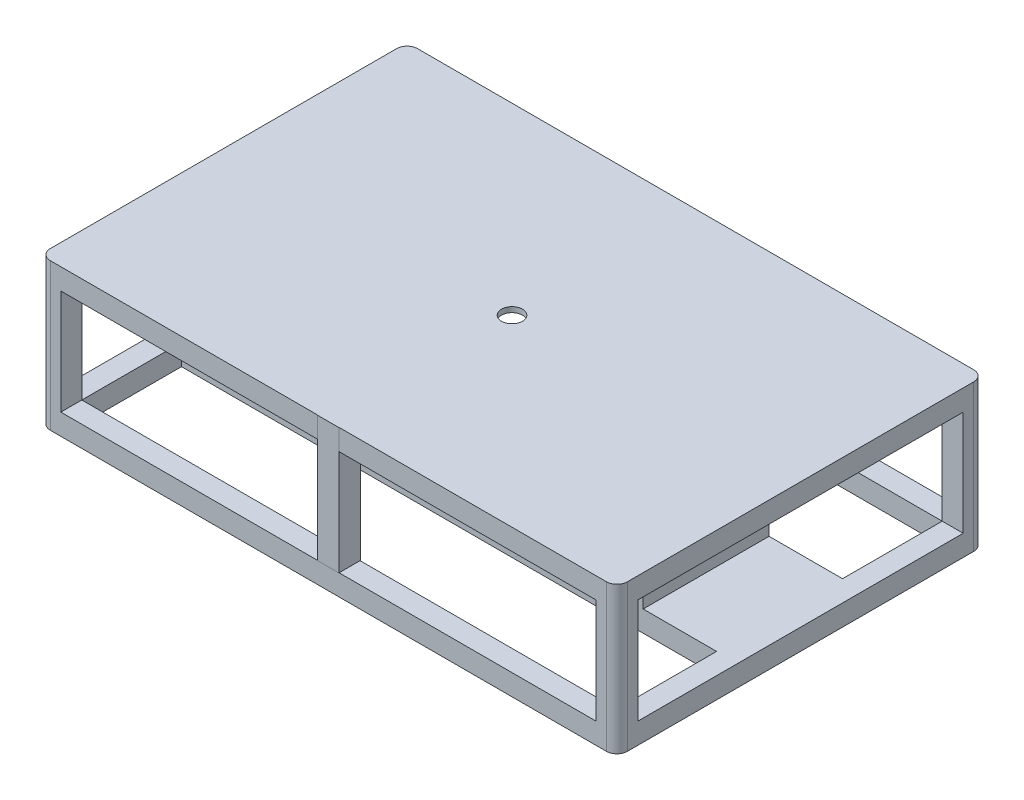
from build123d import *

# Parameters (mm, degrees)
SKETCH1_W           = 550
SKETCH1_H           = 350
SKETCH1_W_2         = 510
SKETCH1_H_2         = 310
BOSS_EXTRUDE1_DEPTH = 20
SKETCH3_W           = 20
SKETCH3_H           = 20
SKETCH3_W_2         = 20.022451752
SKETCH3_H_2         = 20.022451752
SKETCH3_W_3         = 20.433308148
SKETCH3_H_3         = 20.433308148
BOSS_EXTRUDE2_DEPTH = 120
SKETCH4_W           = 550
SKETCH4_H           = 350
SKETCH4_W_2         = 510
SKETCH4_H_2         = 310
BOSS_EXTRUDE3_DEPTH = 20
SKETCH5_W           = 550
SKETCH5_H           = 350
BOSS_EXTRUDE4_DEPTH = 5
SKETCH6_W           = 550
SKETCH6_H           = 120
BOSS_EXTRUDE5_DEPTH = 20
SKETCH7_W           = 49.868309686
SKETCH7_H           = 40
SKETCH7_W_2         = 49.961884124
BOSS_EXTRUDE6_DEPTH = 120
SKETCH8_R           = 5
CUT_EXTRUDE1_DEPTH  = 181
FILLET1_R           = 10
SKETCH9_R           = 10
CUT_EXTRUDE2_DEPTH  = 43


with BuildPart() as part:
    # Sketch1 → Boss-Extrude1 (new body)
    with BuildSketch(Plane(origin=(0, 0, 0), x_dir=(1, 0, 0), z_dir=(0, 1, 0))):
        Rectangle(SKETCH1_W, SKETCH1_H)
        Rectangle(SKETCH1_W_2, SKETCH1_H_2, mode=Mode.SUBTRACT)
    extrude(amount=BOSS_EXTRUDE1_DEPTH)

    # Sketch3 → Boss-Extrude2 (add)
    with BuildSketch(Plane(origin=(0, 20, 0), x_dir=(1, 0, 0), z_dir=(0, 1, 0))):
        with Locations((-265, 165)):
            Rectangle(SKETCH3_W, SKETCH3_H)
        with Locations((-265, -165)):
            Rectangle(SKETCH3_W, SKETCH3_H)
        with Locations((265, -165)):
            Rectangle(SKETCH3_W, SKETCH3_H)
        with Locations((265, 165)):
            Rectangle(SKETCH3_W, SKETCH3_H)
        with Locations((0, 165)):
            Rectangle(SKETCH3_W_2, SKETCH3_H_2)
        with Locations((0, -165)):
            Rectangle(SKETCH3_W_3, SKETCH3_H_3)
    extrude(amount=BOSS_EXTRUDE2_DEPTH)

    # Sketch4 → Boss-Extrude3 (add)
    with BuildSketch(Plane(origin=(0, 140, 0), x_dir=(1, 0, 0), z_dir=(0, 1, 0))):
        Rectangle(SKETCH4_W, SKETCH4_H)
        Rectangle(SKETCH4_W_2, SKETCH4_H_2, mode=Mode.SUBTRACT)
    extrude(amount=-BOSS_EXTRUDE3_DEPTH)

    # Sketch5 → Boss-Extrude4 (add)
    with BuildSketch(Plane(origin=(0, 140, 0), x_dir=(1, 0, 0), z_dir=(0, 1, 0))):
        Rectangle(SKETCH5_W, SKETCH5_H)
    extrude(amount=-BOSS_EXTRUDE4_DEPTH)

    # Sketch6 → Boss-Extrude5 (add)
    with BuildSketch(Plane.XZ):
        Rectangle(SKETCH6_W, SKETCH6_H)
    extrude(amount=-BOSS_EXTRUDE5_DEPTH)

    # Sketch7 → Boss-Extrude6 (add)
    with BuildSketch(Plane.XY.offset(60)):
        with Locations((-159.939483021, 20)):
            Rectangle(SKETCH7_W, SKETCH7_H)
        with Locations((160.017500796, 20)):
            Rectangle(SKETCH7_W_2, SKETCH7_H)
    extrude(amount=-BOSS_EXTRUDE6_DEPTH)

    # Sketch8 → Cut-Extrude1 (cut)
    with BuildSketch(Plane.XY.offset(60)):
        with Locations((160.017500796, 20)):
            Circle(SKETCH8_R)
        with Locations((-159.939483021, 20)):
            Circle(SKETCH8_R)
    extrude(amount=-CUT_EXTRUDE1_DEPTH, mode=Mode.SUBTRACT)

    # Fillet1
    fillet1_edges = [part.edges().sort_by_distance(p)[0] for p in [
        (275, 70, 175),
        (-275, 70, 175),
        (-275, 70, -175),
        (275, 70, -175),
    ]]
    fillet(fillet1_edges, radius=FILLET1_R)

    # Sketch9 → Cut-Extrude2 (cut)
    with BuildSketch(Plane(origin=(0, 140, 0), x_dir=(1, 0, 0), z_dir=(0, 1, 0))):
        with Locations(Location((0, 0, 0), (0, 0, 270))):
            Circle(SKETCH9_R)
    extrude(amount=-CUT_EXTRUDE2_DEPTH, mode=Mode.SUBTRACT)


solid = part.part
